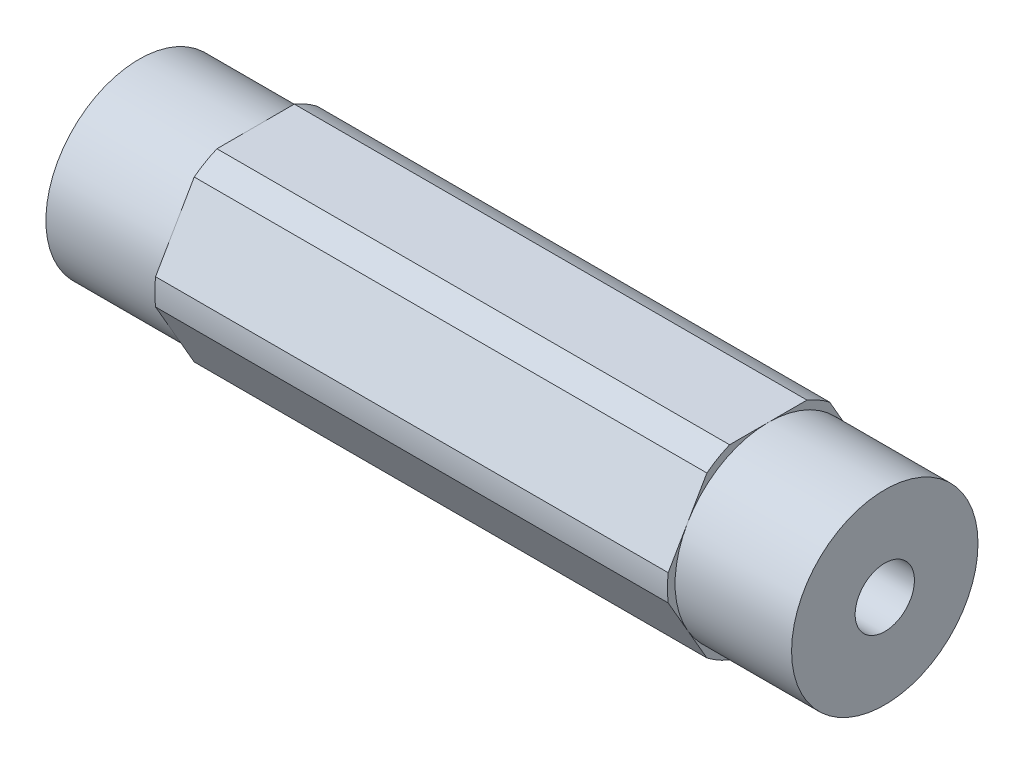
from build123d import *

# Parameters (mm, degrees)
SKETCH1_R               = 2.0193
BOSS_EXTRUDE1_DEPTH     = 25.4
SKETCH3_R               = 8.89
SKETCH3_R_2             = 6.35
CUT_EXTRUDE_THIN1_DEPTH = 7.9375


with BuildPart() as part:
    # Sketch1 → Boss-Extrude1 (new, symmetric)
    with BuildSketch(Plane(origin=(0, 0, 0), x_dir=(0, 0, -1), z_dir=(1, 0, 0))):
        with BuildLine():
            ThreePointArc((4.181770846, 5.456960429), (3.437499983, 5.953924622), (2.634980936, 6.35))
            Line((2.634980936, 6.35), (-2.634980936, 6.35))
            ThreePointArc((-2.634980936, 6.35), (-3.437499983, 5.953924622), (-4.181770846, 5.456960429))
            Line((-4.181770846, 5.456960429), (-6.816751782, 0.893039571))
            ThreePointArc((-6.816751782, 0.893039571), (-6.874999966, 0), (-6.816751782, -0.893039571))
            Line((-6.816751782, -0.893039571), (-4.181770846, -5.456960429))
            ThreePointArc((-4.181770846, -5.456960429), (-3.437499983, -5.953924622), (-2.634980936, -6.35))
            Line((-2.634980936, -6.35), (2.634980936, -6.35))
            ThreePointArc((2.634980936, -6.35), (3.437499983, -5.953924622), (4.181770846, -5.456960429))
            Line((4.181770846, -5.456960429), (6.816751782, -0.893039571))
            ThreePointArc((6.816751782, -0.893039571), (6.860422465, -0.447468582), (6.874999966, 0))
            ThreePointArc((6.874999966, 0), (6.860422465, 0.447468582), (6.816751782, 0.893039571))
            Line((6.816751782, 0.893039571), (4.181770846, 5.456960429))
        make_face()
        Circle(SKETCH1_R, mode=Mode.SUBTRACT)
    extrude(amount=BOSS_EXTRUDE1_DEPTH, both=True)

    # Sketch3 → Cut-Extrude-Thin1 (cut)
    with BuildSketch(Plane(origin=(25.4, 0, 0), x_dir=(0, 0, -1), z_dir=(1, 0, 0))):
        Circle(SKETCH3_R)
        Circle(SKETCH3_R_2, mode=Mode.SUBTRACT)
    cut_extrude_thin1 = extrude(amount=-CUT_EXTRUDE_THIN1_DEPTH, mode=Mode.SUBTRACT)

    # Mirror1: Cut-Extrude-Thin1 across plane
    add(cut_extrude_thin1.mirror(Plane(origin=(0, 0, 0), x_dir=(0, 0, 1), z_dir=(1, 0, 0))), mode=Mode.SUBTRACT)


solid = part.part
